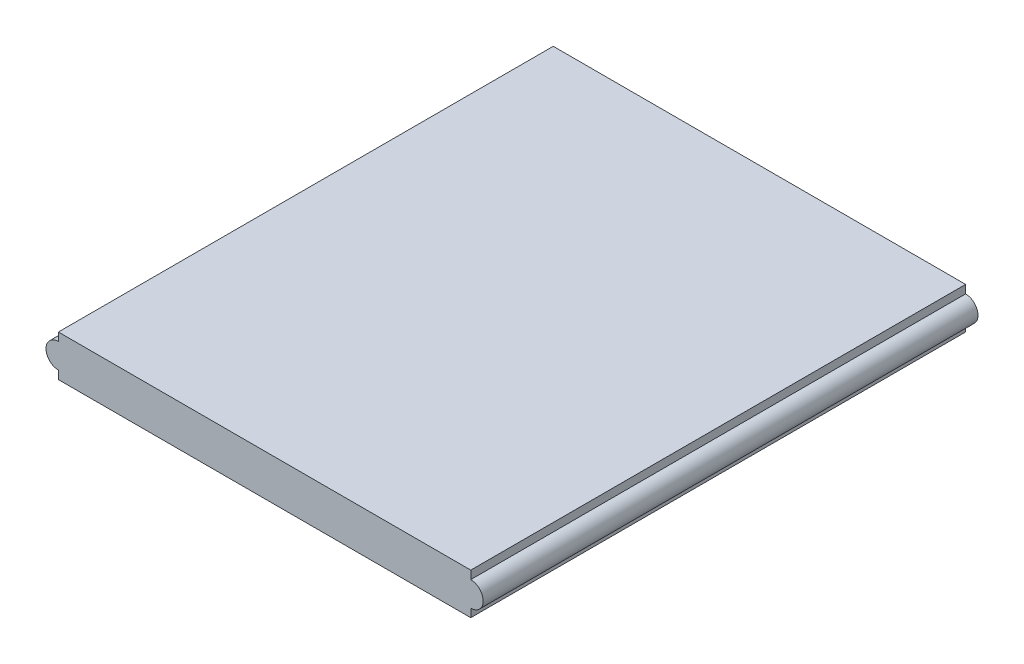
from build123d import *

# Parameters (mm, degrees)
SALIENTE_EXTRUIR1_DEPTH = 60
CORTAR_EXTRUIR1_DEPTH   = 10


with BuildPart() as part:
    # Croquis1 → Saliente-Extruir1 (new body)
    with BuildSketch(Plane.XY):
        with BuildLine():
            Line((-71.508108108, 44.822972973), (-71.508108108, 45.822972973))
            Line((-71.508108108, 45.822972973), (-21.508108108, 45.822972973))
            Line((-21.508108108, 45.822972973), (-21.508108108, 44.822972973))
            ThreePointArc((-21.508108108, 44.822972973), (-20.008108108, 43.322972973), (-21.508108108, 41.822972973))
            Line((-21.508108108, 41.822972973), (-21.508108108, 40.822972973))
            Line((-21.508108108, 40.822972973), (-71.508108108, 40.822972973))
            Line((-71.508108108, 40.822972973), (-71.508108108, 41.822972973))
            ThreePointArc((-71.508108108, 41.822972973), (-73.008108108, 43.322972973), (-71.508108108, 44.822972973))
        make_face()
    extrude(amount=SALIENTE_EXTRUIR1_DEPTH)

    # Croquis3 → Cortar-Extruir1 (cut)
    with BuildSketch(Plane(origin=(0, 0, 0), x_dir=(-1, 0, 0), z_dir=(0, 0, -1))):
        with BuildLine():
            Line((36.508108108, 41.322972973), (36.508108108, 40.822972973))
            Line((36.508108108, 40.822972973), (56.508108108, 40.822972973))
            Line((56.508108108, 40.822972973), (56.508108108, 41.322972973))
            ThreePointArc((56.508108108, 41.322972973), (55.92232167, 42.737186535), (54.508108108, 43.322972973))
            Line((54.508108108, 43.322972973), (38.508108108, 43.322972973))
            ThreePointArc((38.508108108, 43.322972973), (37.093894546, 42.737186535), (36.508108108, 41.322972973))
        make_face()
    extrude(amount=-CORTAR_EXTRUIR1_DEPTH, mode=Mode.SUBTRACT)


solid = part.part
